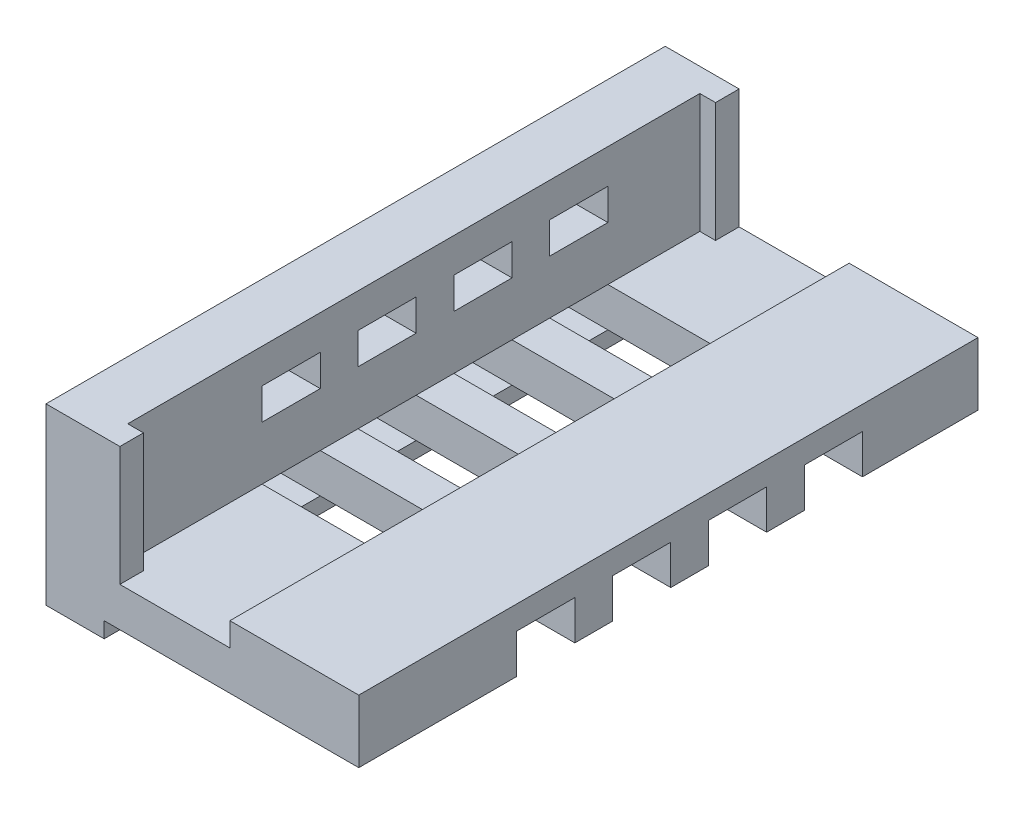
from build123d import *

# Parameters (mm, degrees)
RESSALTO_EXTRUS_O1_DEPTH = 39.4
ESBO_O2_W                = 3.7
ESBO_O2_H                = 2.5
CORTE_EXTRUS_O1_DEPTH    = 46.281121894
ESBO_O3_W                = 3.7
ESBO_O3_H                = 2
CORTE_EXTRUS_O2_DEPTH    = 10
PADR_O_LINEAR1_COUNT     = 4
PADR_O_LINEAR1_PITCH     = 6.1
ESBO_O5_W                = 1.5
ESBO_O5_H                = 7.6
RESSALTO_EXTRUS_O2_DEPTH = 1


with BuildPart() as part:
    # Esboço1 → Ressalto-extrusão1 (new body)
    with BuildSketch(Plane.XY):
        Polygon((0, 0), (0, 10.1), (3.7, 10.1), (3.7, 2.5), (11.7, 2.5), (11.7, 4), (19.9, 4), (19.9, 0), (3.7, 0), (3.7, -1), (0, -1), align=None)
    extrude(amount=-RESSALTO_EXTRUS_O1_DEPTH)

    # Esboço2 → Corte-extrusão1 (cut, through all)
    with BuildSketch(Plane(origin=(19.9, 0, 0), x_dir=(0, 0, -1), z_dir=(1, 0, 0))):
        with Locations((11.9, 1.25)):
            Rectangle(ESBO_O2_W, ESBO_O2_H)
    corte_extrus_o1 = extrude(amount=-CORTE_EXTRUS_O1_DEPTH, mode=Mode.SUBTRACT)

    # Esboço3 → Corte-extrusão2 (cut)
    with BuildSketch(Plane(origin=(3.7, 0, 0), x_dir=(0, 0, -1), z_dir=(1, 0, 0))):
        with Locations((11.9, 6.914453418)):
            Rectangle(ESBO_O3_W, ESBO_O3_H)
    corte_extrus_o2 = extrude(amount=-CORTE_EXTRUS_O2_DEPTH, mode=Mode.SUBTRACT)

    # Padrão linear1: Corte-extrusão1, Corte-extrusão2 ×4
    with Locations(*[(0, 0, -i * PADR_O_LINEAR1_PITCH) for i in range(1, PADR_O_LINEAR1_COUNT)]):
        add(corte_extrus_o1, mode=Mode.SUBTRACT)
        add(corte_extrus_o2, mode=Mode.SUBTRACT)

    # Esboço5 → Ressalto-extrusão2 (add)
    with BuildSketch(Plane(origin=(3.7, 0, 0), x_dir=(0, 0, -1), z_dir=(1, 0, 0))):
        with Locations((0.75, 6.3)):
            Rectangle(ESBO_O5_W, ESBO_O5_H)
    ressalto_extrus_o2 = extrude(amount=RESSALTO_EXTRUS_O2_DEPTH)

    # Espelhar1: Ressalto-extrusão2 across plane
    add(ressalto_extrus_o2.mirror(Plane.XY.offset(-19.7)))


solid = part.part
